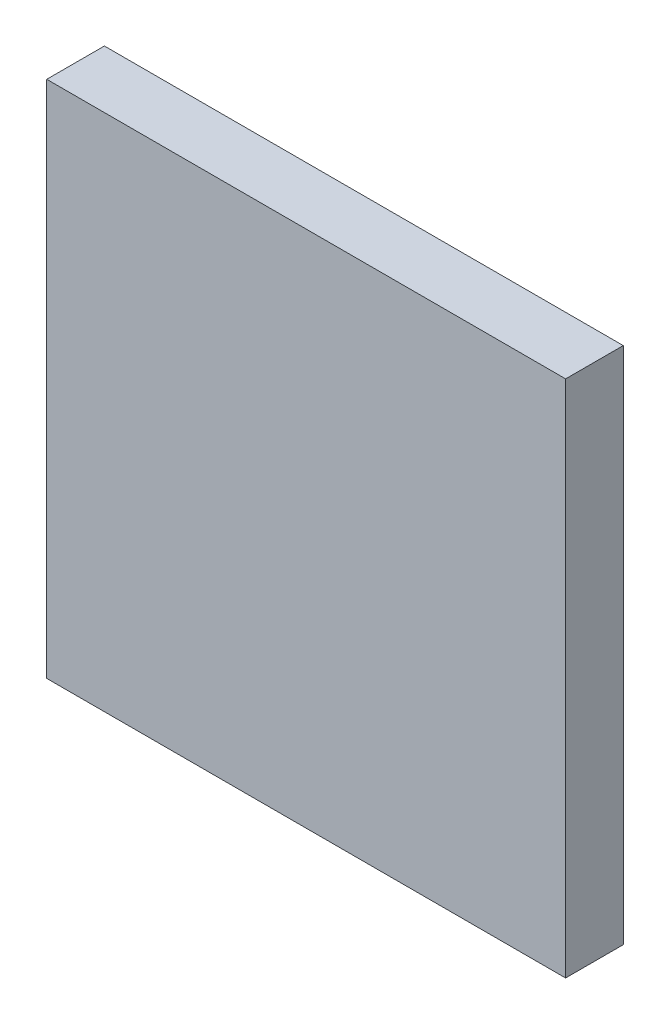
from build123d import *

# Parameters (mm, degrees)
SKETCH_1_W          = 27
SKETCH_1_H          = 27
EXTRUDE_1_DEPTH     = 3
SKETCH_2_W          = 4
SKETCH_2_H          = 1
SKETCH_2_W_2        = 1
SKETCH_2_H_2        = 4
CUT_EXTRUDE_1_DEPTH = 2


with BuildPart() as part:
    # Эскиз1 → Бобышка-Вытянуть1 (new body)
    with BuildSketch(Plane.XY):
        Rectangle(SKETCH_1_W, SKETCH_1_H)
    extrude(amount=EXTRUDE_1_DEPTH)

    # Эскиз2 → Вырез-Вытянуть1 (cut)
    with BuildSketch(Plane(origin=(0, 0, 0), x_dir=(-1, 0, 0), z_dir=(0, 0, -1))):
        Polygon((-0.5, -0.5), (-1.5, -0.5), (-1.5, 0.5), (-0.5, 0.5), (-0.5, 1.5), (0.5, 1.5), (0.5, 0.5), (1.5, 0.5), (1.5, -0.5), (0.5, -0.5), (0.5, -1.5), (-0.5, -1.5), align=None)
        Polygon((-0.5, -9.5), (-1.5, -9.5), (-1.5, -8.5), (-0.5, -8.5), (-0.5, -7.5), (0.5, -7.5), (0.5, -8.5), (1.5, -8.5), (1.5, -9.5), (0.5, -9.5), (0.5, -10.5), (-0.5, -10.5), align=None)
        Polygon((-0.5, 8.5), (-0.5, 7.5), (0.5, 7.5), (0.5, 8.5), (1.5, 8.5), (1.5, 9.5), (0.5, 9.5), (0.5, 10.5), (-0.5, 10.5), (-0.5, 9.5), (-1.5, 9.5), (-1.5, 8.5), align=None)
        Polygon((2.5, -0.5), (5.5, -0.5), (5.5, -1.5), (6.5, -1.5), (6.5, -2.5), (7.5, -2.5), (7.5, -3.5), (8.5, -3.5), (8.5, -4.5), (5.5, -4.5), (5.5, -3.5), (4.5, -3.5), (4.5, -2.5), (3.5, -2.5), (3.5, -1.5), (2.5, -1.5), align=None)
        Polygon((5.5, -10.5), (5.5, -5.5), (10.5, -5.5), (10.5, -6.5), (6.5, -6.5), (6.5, -10.5), align=None)
        Polygon((8.5, -12.5), (7.5, -12.5), (7.5, -7.5), (12.5, -7.5), (12.5, -8.5), (8.5, -8.5), align=None)
        Polygon((9.5, -12.5), (9.5, -10.5), (10.5, -10.5), (10.5, -9.5), (12.5, -9.5), (12.5, -10.5), (11.5, -10.5), (11.5, -11.5), (10.5, -11.5), (10.5, -12.5), align=None)
        Polygon((0.5, -2.5), (0.5, -6.5), (1.5, -6.5), (1.5, -7.5), (2.5, -7.5), (2.5, -8.5), (3.5, -8.5), (3.5, -9.5), (4.5, -9.5), (4.5, -5.5), (3.5, -5.5), (3.5, -4.5), (2.5, -4.5), (2.5, -3.5), (1.5, -3.5), (1.5, -2.5), align=None)
        with Locations((2.5, -12)):
            Rectangle(SKETCH_2_W, SKETCH_2_H)
        Polygon((8.5, -0.5), (7.5, -0.5), (7.5, 0.5), (8.5, 0.5), (8.5, 1.5), (9.5, 1.5), (9.5, 0.5), (10.5, 0.5), (10.5, -0.5), (9.5, -0.5), (9.5, -1.5), (8.5, -1.5), align=None)
        Polygon((-9.5, -0.5), (-10.5, -0.5), (-10.5, 0.5), (-9.5, 0.5), (-9.5, 1.5), (-8.5, 1.5), (-8.5, 0.5), (-7.5, 0.5), (-7.5, -0.5), (-8.5, -0.5), (-8.5, -1.5), (-9.5, -1.5), align=None)
        with Locations((-2.5, -12)):
            Rectangle(SKETCH_2_W, SKETCH_2_H)
        Polygon((-10.5, -12.5), (-9.5, -12.5), (-9.5, -10.5), (-10.5, -10.5), (-10.5, -9.5), (-12.5, -9.5), (-12.5, -10.5), (-11.5, -10.5), (-11.5, -11.5), (-10.5, -11.5), align=None)
        Polygon((-12.5, -8.5), (-8.5, -8.5), (-8.5, -12.5), (-7.5, -12.5), (-7.5, -7.5), (-12.5, -7.5), align=None)
        Polygon((-6.5, -6.5), (-6.5, -10.5), (-5.5, -10.5), (-5.5, -5.5), (-10.5, -5.5), (-10.5, -6.5), align=None)
        Polygon((-3.5, -1.5), (-2.5, -1.5), (-2.5, -0.5), (-5.5, -0.5), (-5.5, -1.5), (-6.5, -1.5), (-6.5, -2.5), (-7.5, -2.5), (-7.5, -3.5), (-8.5, -3.5), (-8.5, -4.5), (-5.5, -4.5), (-5.5, -3.5), (-4.5, -3.5), (-4.5, -2.5), (-3.5, -2.5), align=None)
        Polygon((-3.5, -9.5), (-4.5, -9.5), (-4.5, -5.5), (-3.5, -5.5), (-3.5, -4.5), (-2.5, -4.5), (-2.5, -3.5), (-1.5, -3.5), (-1.5, -2.5), (-0.5, -2.5), (-0.5, -6.5), (-1.5, -6.5), (-1.5, -7.5), (-2.5, -7.5), (-2.5, -8.5), (-3.5, -8.5), align=None)
        with Locations((12, -2.5)):
            Rectangle(SKETCH_2_W_2, SKETCH_2_H_2)
        with Locations((-12, -2.5)):
            Rectangle(SKETCH_2_W_2, SKETCH_2_H_2)
        Polygon((-10.5, 11.5), (-10.5, 12.5), (-9.5, 12.5), (-9.5, 10.5), (-10.5, 10.5), (-10.5, 9.5), (-12.5, 9.5), (-12.5, 10.5), (-11.5, 10.5), (-11.5, 11.5), align=None)
        Polygon((-12.5, 7.5), (-12.5, 8.5), (-8.5, 8.5), (-8.5, 12.5), (-7.5, 12.5), (-7.5, 7.5), align=None)
        Polygon((-10.5, 6.5), (-6.5, 6.5), (-6.5, 10.5), (-5.5, 10.5), (-5.5, 5.5), (-10.5, 5.5), align=None)
        with Locations((-12, 2.5)):
            Rectangle(SKETCH_2_W_2, SKETCH_2_H_2)
        Polygon((-3.5, 2.5), (-3.5, 1.5), (-2.5, 1.5), (-2.5, 0.5), (-5.5, 0.5), (-5.5, 1.5), (-6.5, 1.5), (-6.5, 2.5), (-7.5, 2.5), (-7.5, 3.5), (-8.5, 3.5), (-8.5, 4.5), (-5.5, 4.5), (-5.5, 3.5), (-4.5, 3.5), (-4.5, 2.5), align=None)
        Polygon((-3.5, 8.5), (-3.5, 9.5), (-4.5, 9.5), (-4.5, 5.5), (-3.5, 5.5), (-3.5, 4.5), (-2.5, 4.5), (-2.5, 3.5), (-1.5, 3.5), (-1.5, 2.5), (-0.5, 2.5), (-0.5, 6.5), (-1.5, 6.5), (-1.5, 7.5), (-2.5, 7.5), (-2.5, 8.5), align=None)
        with Locations((-2.5, 12)):
            Rectangle(SKETCH_2_W, SKETCH_2_H)
        with Locations((2.5, 12)):
            Rectangle(SKETCH_2_W, SKETCH_2_H)
        Polygon((3.5, 9.5), (4.5, 9.5), (4.5, 5.5), (3.5, 5.5), (3.5, 4.5), (2.5, 4.5), (2.5, 3.5), (1.5, 3.5), (1.5, 2.5), (0.5, 2.5), (0.5, 6.5), (1.5, 6.5), (1.5, 7.5), (2.5, 7.5), (2.5, 8.5), (3.5, 8.5), align=None)
        Polygon((10.5, 12.5), (9.5, 12.5), (9.5, 10.5), (10.5, 10.5), (10.5, 9.5), (12.5, 9.5), (12.5, 10.5), (11.5, 10.5), (11.5, 11.5), (10.5, 11.5), align=None)
        Polygon((12.5, 8.5), (8.5, 8.5), (8.5, 12.5), (7.5, 12.5), (7.5, 7.5), (12.5, 7.5), align=None)
        Polygon((6.5, 6.5), (6.5, 10.5), (5.5, 10.5), (5.5, 5.5), (10.5, 5.5), (10.5, 6.5), align=None)
        Polygon((3.5, 1.5), (2.5, 1.5), (2.5, 0.5), (5.5, 0.5), (5.5, 1.5), (6.5, 1.5), (6.5, 2.5), (7.5, 2.5), (7.5, 3.5), (8.5, 3.5), (8.5, 4.5), (5.5, 4.5), (5.5, 3.5), (4.5, 3.5), (4.5, 2.5), (3.5, 2.5), align=None)
        with Locations((12, 2.5)):
            Rectangle(SKETCH_2_W_2, SKETCH_2_H_2)
    extrude(amount=-CUT_EXTRUDE_1_DEPTH, mode=Mode.SUBTRACT)


solid = part.part
